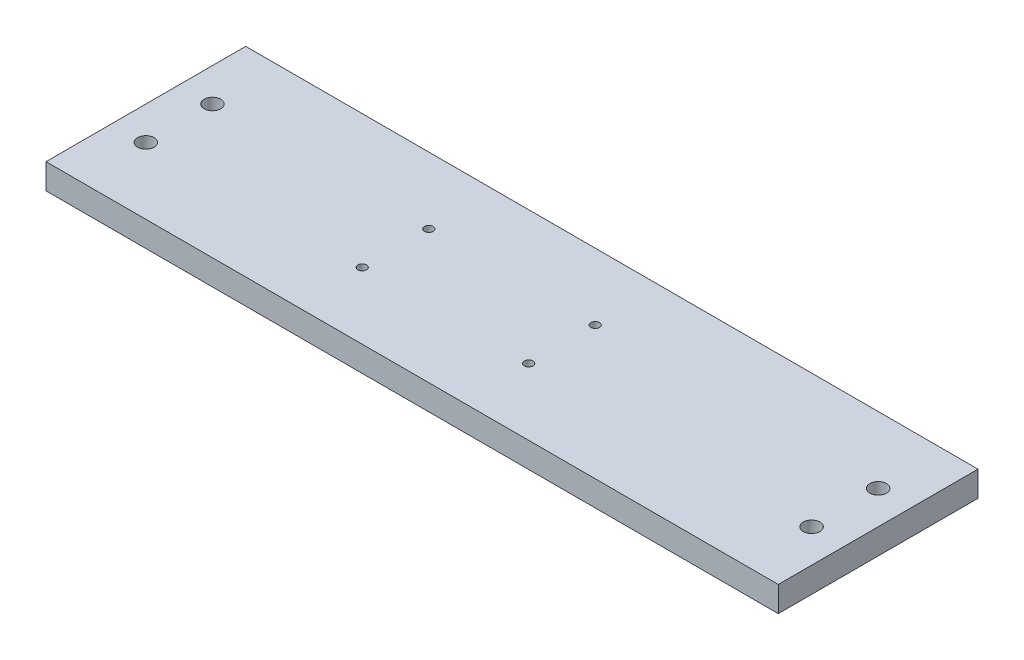
from build123d import *

# Parameters (mm, degrees)
SKETCH1_W           = 279.4
SKETCH1_H           = 76.2
SKETCH1_R           = 3.175
SKETCH1_R_2         = 1.651
BOSS_EXTRUDE1_DEPTH = 4.826


with BuildPart() as part:
    # Sketch1 → Boss-Extrude1 (new, symmetric)
    with BuildSketch(Plane(origin=(0, 0, 0), x_dir=(1, 0, 0), z_dir=(0, 1, 0))):
        Rectangle(SKETCH1_W, SKETCH1_H)
        with Locations(Location((127, 12.7, 0), (0, 0, 270))):
            Circle(SKETCH1_R, mode=Mode.SUBTRACT)
        with Locations(Location((19.05, 12.7, 0), (0, 0, 270))):
            Circle(SKETCH1_R_2, mode=Mode.SUBTRACT)
        with Locations(Location((-44.45, 12.7, 0), (0, 0, 270))):
            Circle(SKETCH1_R_2, mode=Mode.SUBTRACT)
        with Locations(Location((-127, 12.7, 0), (0, 0, 270))):
            Circle(SKETCH1_R, mode=Mode.SUBTRACT)
        with Locations(Location((127, -12.7, 0), (0, 0, 90))):
            Circle(SKETCH1_R, mode=Mode.SUBTRACT)
        with Locations(Location((19.05, -12.7, 0), (0, 0, 90))):
            Circle(SKETCH1_R_2, mode=Mode.SUBTRACT)
        with Locations(Location((-44.45, -12.7, 0), (0, 0, 90))):
            Circle(SKETCH1_R_2, mode=Mode.SUBTRACT)
        with Locations(Location((-127, -12.7, 0), (0, 0, 90))):
            Circle(SKETCH1_R, mode=Mode.SUBTRACT)
    extrude(amount=BOSS_EXTRUDE1_DEPTH, both=True)


solid = part.part
